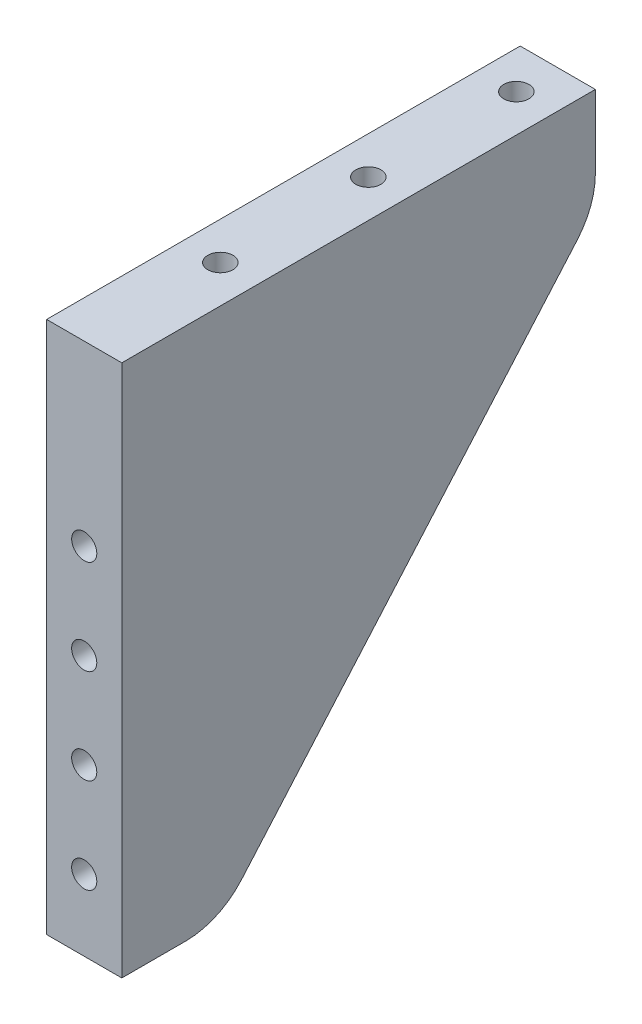
from build123d import *

# Parameters (mm, degrees)
BOSS_EXTRUDE1_DEPTH    = 12.7
CUT_EXTRUDE1_DEPTH     = 31.75
M10_TAPPED_HOLE1_D     = 8.5
M10_TAPPED_HOLE1_DEPTH = 27.5
M10_TAPPED_HOLE1_TIP   = 2.553657631
M10_TAPPED_HOLE2_D     = 8.5
M10_TAPPED_HOLE2_DEPTH = 27.5
M10_TAPPED_HOLE2_TIP   = 2.553657631


with BuildPart() as part:
    # Sketch1 → Boss-Extrude1 (new, symmetric)
    with BuildSketch(Plane(origin=(0, 0, 0), x_dir=(0, 0, -1), z_dir=(1, 0, 0))):
        with BuildLine():
            Line((0, 0), (26.709237708, 0))
            ThreePointArc((26.709237708, 0), (37.074764786, 2.250146189), (45.574375763, 8.595532127))
            Line((45.574375763, 8.595532127), (158.965138054, 138.994908762))
            ThreePointArc((158.965138054, 138.994908762), (163.516110387, 146.642335221), (165.1, 155.399376635))
            Line((165.1, 155.399376635), (165.1, 184.15))
            Line((165.1, 184.15), (0, 184.15))
            Line((0, 184.15), (0, 0))
        make_face()
    extrude(amount=BOSS_EXTRUDE1_DEPTH, both=True)

    # Sketch2 → Cut-Extrude1 (cut)
    with BuildSketch(Plane(origin=(12.7, 0, 0), x_dir=(0, 0, -1), z_dir=(1, 0, 0))):
        Polygon((0, 184.15), (0, 0), (5.1, 0), (5.1, 180), (165.1, 180), (165.1, 184.15), align=None)
    extrude(amount=-CUT_EXTRUDE1_DEPTH, mode=Mode.SUBTRACT)

    # M10 Tapped Hole1
    with Locations(Plane(origin=(0, 180, 0), x_dir=(1, 0, 0), z_dir=(0, 1, 0))):
        with Locations((0, 51.100000098), (0, 101.100000098), (0, 151.100000098)):
            Hole(M10_TAPPED_HOLE1_D / 2, depth=M10_TAPPED_HOLE1_DEPTH)
            with Locations((0, 0, -(M10_TAPPED_HOLE1_DEPTH + M10_TAPPED_HOLE1_TIP / 2))):  # 118° drill point
                Cone(0, M10_TAPPED_HOLE1_D / 2, M10_TAPPED_HOLE1_TIP, mode=Mode.SUBTRACT)

    # M10 Tapped Hole2
    with Locations(Plane.XY.offset(-5.1)):
        with Locations((0, 120), (0, 88), (0, 56), (0, 24)):
            Hole(M10_TAPPED_HOLE2_D / 2, depth=M10_TAPPED_HOLE2_DEPTH)
            with Locations((0, 0, -(M10_TAPPED_HOLE2_DEPTH + M10_TAPPED_HOLE2_TIP / 2))):  # 118° drill point
                Cone(0, M10_TAPPED_HOLE2_D / 2, M10_TAPPED_HOLE2_TIP, mode=Mode.SUBTRACT)


solid = part.part
